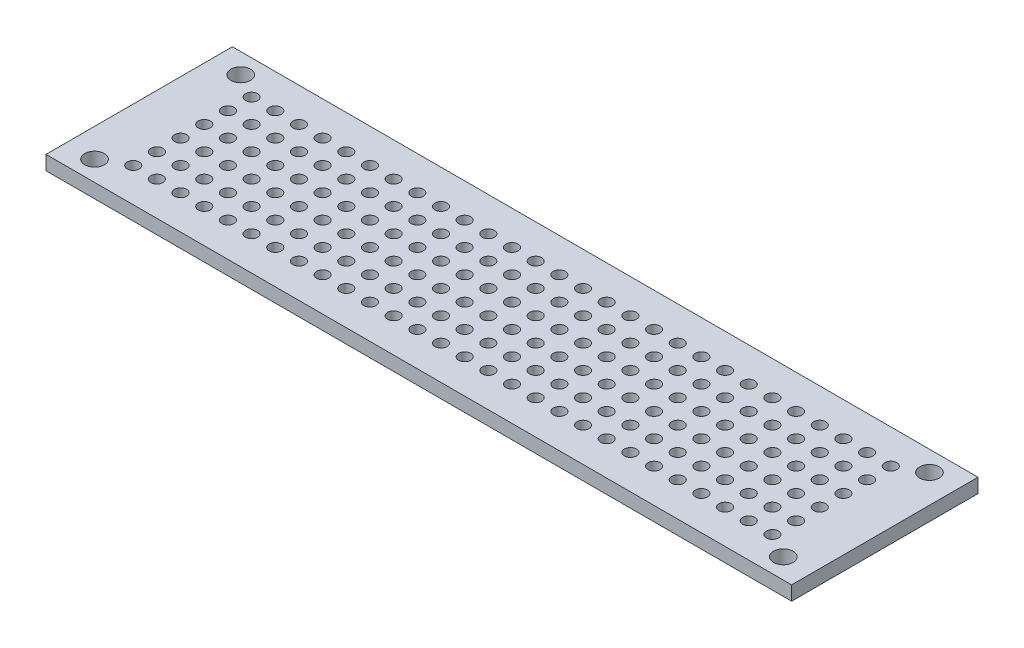
from build123d import *

# Parameters (mm, degrees)
SKETCH1_W                  = 80
SKETCH1_H                  = 20
BOSS_EXTRUDE1_DEPTH        = 0.762
F_1_3_1_3_DIAMETER_HOLE1_D = 1.3
F_2_1_2_1_DIAMETER_HOLE1_D = 2.1


with BuildPart() as part:
    # Sketch1 → Boss-Extrude1 (new, symmetric)
    with BuildSketch(Plane(origin=(0, 0, 0), x_dir=(1, 0, 0), z_dir=(0, 1, 0))):
        with Locations((40, 10)):
            Rectangle(SKETCH1_W, SKETCH1_H)
    extrude(amount=BOSS_EXTRUDE1_DEPTH, both=True)

    # Ø1.3 (1.3) Diameter Hole1 (through all)
    with Locations(Plane(origin=(0, 0.762, 0), x_dir=(1, 0, 0), z_dir=(0, 1, 0))):
        with Locations((5.71, 3.65), (8.25, 3.65), (10.79, 3.65), (13.33, 3.65), (15.87, 3.65), (18.41, 3.65), (20.95, 3.65), (23.49, 3.65), (26.03, 3.65), (28.57, 3.65), (31.11, 3.65), (33.65, 3.65), (36.19, 3.65), (38.73, 3.65), (41.27, 3.65), (43.81, 3.65), (46.35, 3.65), (48.89, 3.65), (51.43, 3.65), (53.97, 3.65), (56.51, 3.65), (59.05, 3.65), (61.59, 3.65), (64.13, 3.65), (8.25, 6.19), (10.79, 6.19), (13.33, 6.19), (15.87, 6.19), (18.41, 6.19), (20.95, 6.19), (23.49, 6.19), (26.03, 6.19), (28.57, 6.19), (31.11, 6.19), (33.65, 6.19), (36.19, 6.19), (38.73, 6.19), (41.27, 6.19), (43.81, 6.19), (46.35, 6.19), (48.89, 6.19), (51.43, 6.19), (53.97, 6.19), (56.51, 6.19), (59.05, 6.19), (61.59, 6.19), (64.13, 6.19), (8.25, 8.73), (10.79, 8.73), (13.33, 8.73), (15.87, 8.73), (18.41, 8.73), (20.95, 8.73), (23.49, 8.73), (26.03, 8.73), (28.57, 8.73), (31.11, 8.73), (33.65, 8.73), (36.19, 8.73), (38.73, 8.73), (41.27, 8.73), (43.81, 8.73), (46.35, 8.73), (48.89, 8.73), (51.43, 8.73), (53.97, 8.73), (56.51, 8.73), (59.05, 8.73), (61.59, 8.73), (64.13, 8.73), (8.25, 11.27), (10.79, 11.27), (13.33, 11.27), (15.87, 11.27), (18.41, 11.27), (20.95, 11.27), (23.49, 11.27), (26.03, 11.27), (28.57, 11.27), (31.11, 11.27), (33.65, 11.27), (36.19, 11.27), (38.73, 11.27), (41.27, 11.27), (43.81, 11.27), (46.35, 11.27), (48.89, 11.27), (51.43, 11.27), (53.97, 11.27), (56.51, 11.27), (59.05, 11.27), (61.59, 11.27), (64.13, 11.27), (8.25, 13.81), (10.79, 13.81), (13.33, 13.81), (15.87, 13.81), (18.41, 13.81), (20.95, 13.81), (23.49, 13.81), (26.03, 13.81), (28.57, 13.81), (31.11, 13.81), (33.65, 13.81), (36.19, 13.81), (38.73, 13.81), (41.27, 13.81), (43.81, 13.81), (46.35, 13.81), (48.89, 13.81), (51.43, 13.81), (53.97, 13.81), (56.51, 13.81), (59.05, 13.81), (61.59, 13.81), (64.13, 13.81), (8.25, 16.35), (10.79, 16.35), (13.33, 16.35), (15.87, 16.35), (18.41, 16.35), (20.95, 16.35), (23.49, 16.35), (26.03, 16.35), (28.57, 16.35), (31.11, 16.35), (33.65, 16.35), (36.19, 16.35), (38.73, 16.35), (41.27, 16.35), (43.81, 16.35), (46.35, 16.35), (48.89, 16.35), (51.43, 16.35), (53.97, 16.35), (56.51, 16.35), (59.05, 16.35), (61.59, 16.35), (64.13, 16.35), (5.71, 6.19), (5.71, 8.73), (5.71, 11.27), (5.71, 13.81), (5.71, 16.35), (66.67, 3.65), (69.21, 3.65), (71.75, 3.65), (74.29, 3.65), (66.67, 6.19), (69.21, 6.19), (71.75, 6.19), (74.29, 6.19), (66.67, 8.73), (69.21, 8.73), (71.75, 8.73), (74.29, 8.73), (66.67, 11.27), (69.21, 11.27), (71.75, 11.27), (74.29, 11.27), (66.67, 13.81), (69.21, 13.81), (71.75, 13.81), (74.29, 13.81), (66.67, 16.35), (69.21, 16.35), (71.75, 16.35), (74.29, 16.35)):
            Hole(F_1_3_1_3_DIAMETER_HOLE1_D / 2)

    # Ø2.1 (2.1) Diameter Hole1 (through all)
    with Locations(Plane(origin=(0, 0.762, 0), x_dir=(1, 0, 0), z_dir=(0, 1, 0))):
        with Locations((3.048, 17.841), (76.952, 2.159), (76.952, 17.841), (3.048, 2.159)):
            Hole(F_2_1_2_1_DIAMETER_HOLE1_D / 2)


solid = part.part
